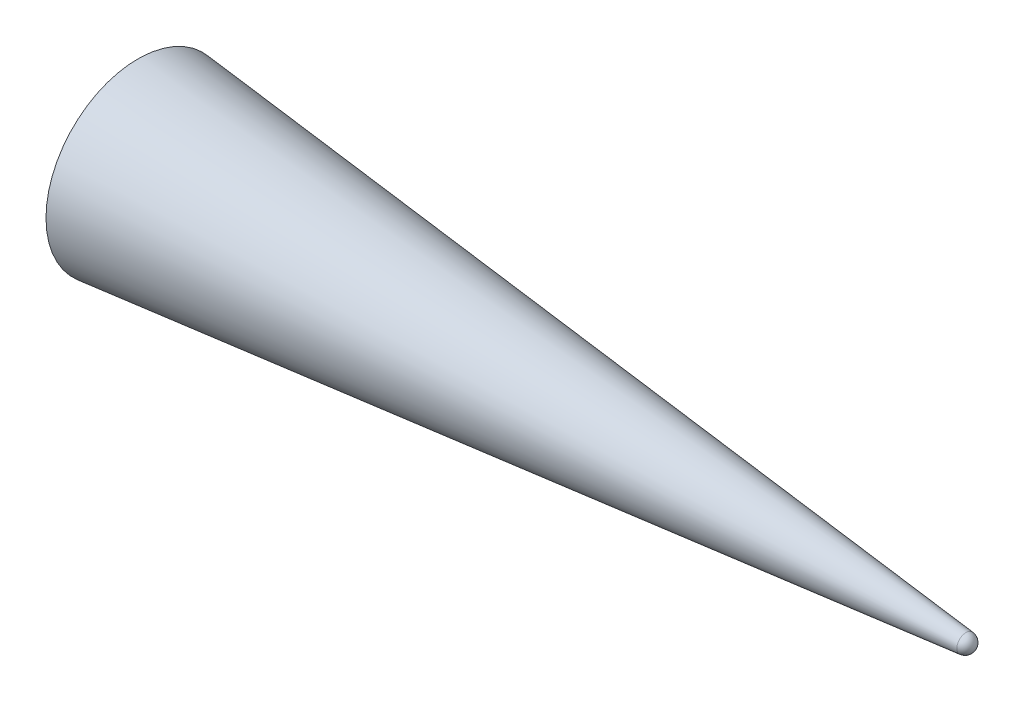
from build123d import *


with BuildPart() as part:
    # Sketch1 → Revolve2 (revolve)
    with BuildSketch(Plane(origin=(0, 0, 0), x_dir=(1, 0, 0), z_dir=(0, 1, 0))):
        with BuildLine():
            Line((900.99009901, 9.900990099), (0, 100))
            Line((0, 100), (0, 0))
            Line((0, 0), (909.950371902, 0))
            ThreePointArc((909.950371902, 0), (907.377728457, 6.67675249), (900.99009901, 9.900990099))
        make_face()
    revolve(axis=Axis((0, 0, 0), (1, 0, 0)))


solid = part.part
